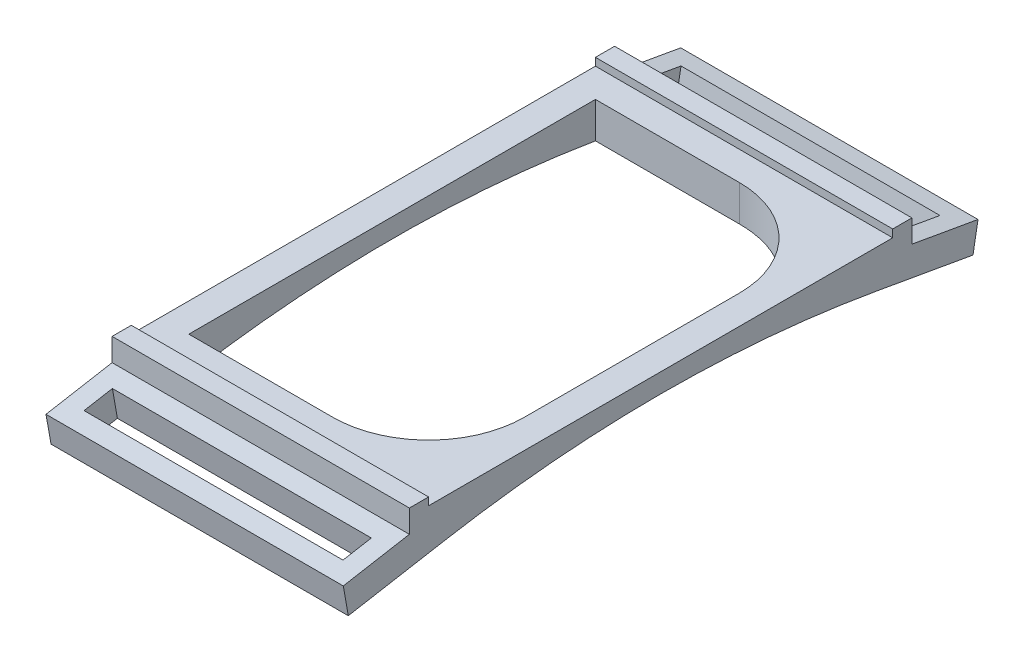
from build123d import *

# Parameters (mm, degrees)
BOSS_EXTRUDE1_DEPTH = 31
SKETCH2_W           = 27
SKETCH2_H           = 3
CUT_EXTRUDE1_DEPTH  = 47.54655438
SKETCH3_W           = 25
SKETCH3_H           = 42.4
CUT_EXTRUDE2_DEPTH  = 46.707660351
FILLET1_R           = 10


with BuildPart() as part:
    # Sketch1 → Boss-Extrude1 (new body)
    with BuildSketch(Plane(origin=(0, 0, 0), x_dir=(0, 0, -1), z_dir=(1, 0, 0))):
        with BuildLine():
            Line((-24.2, 0), (24.2, 0))
            Line((24.2, 0), (24.2, 0.8))
            Line((24.2, 0.8), (26.2, 0.8))
            Line((26.2, 0.8), (26.2, -1.574624922))
            Line((26.2, -1.574624922), (33.093654271, -2.790162166))
            Line((33.093654271, -2.790162166), (32.572709738, -5.744585425))
            Line((32.572709738, -5.744585425), (22.5, -3.968494929))
            ThreePointArc((22.5, -3.968494929), (0, -2), (-22.5, -3.968494929))
            Line((-22.5, -3.968494929), (-32.572709738, -5.744585425))
            Line((-32.572709738, -5.744585425), (-33.093654271, -2.790162166))
            Line((-33.093654271, -2.790162166), (-26.2, -1.574624922))
            Line((-26.2, -1.574624922), (-26.2, 0.8))
            Line((-26.2, 0.8), (-24.2, 0.8))
            Line((-24.2, 0.8), (-24.2, 0))
        make_face()
    extrude(amount=BOSS_EXTRUDE1_DEPTH)

    # Sketch2 → Cut-Extrude1 (cut, through all)
    with BuildSketch(Plane(origin=(0, 2.953319706, -0.520749947), x_dir=(1, 0, 0), z_dir=(0, 0.9848077530122087, -0.17364817766692767))):
        with Locations((15.5, 29.575393877)):
            Rectangle(SKETCH2_W, SKETCH2_H)
    cut_extrude1 = extrude(amount=-CUT_EXTRUDE1_DEPTH, mode=Mode.SUBTRACT)

    # Mirror1: Cut-Extrude1 across plane
    add(cut_extrude1.mirror(Plane.XY), mode=Mode.SUBTRACT)

    # Sketch3 → Cut-Extrude2 (cut, through all)
    with BuildSketch(Plane(origin=(0, 0, 0), x_dir=(1, 0, 0), z_dir=(0, 1, 0))):
        with Locations((15.5, 0)):
            Rectangle(SKETCH3_W, SKETCH3_H)
    extrude(amount=-CUT_EXTRUDE2_DEPTH, mode=Mode.SUBTRACT)

    # Fillet1
    fillet1_edges = [part.edges().sort_by_distance(p)[0] for p in [
        (28, -1.873042869, -21.2),
        (28, -1.873042869, 21.2),
    ]]
    fillet(fillet1_edges, radius=FILLET1_R)


solid = part.part
